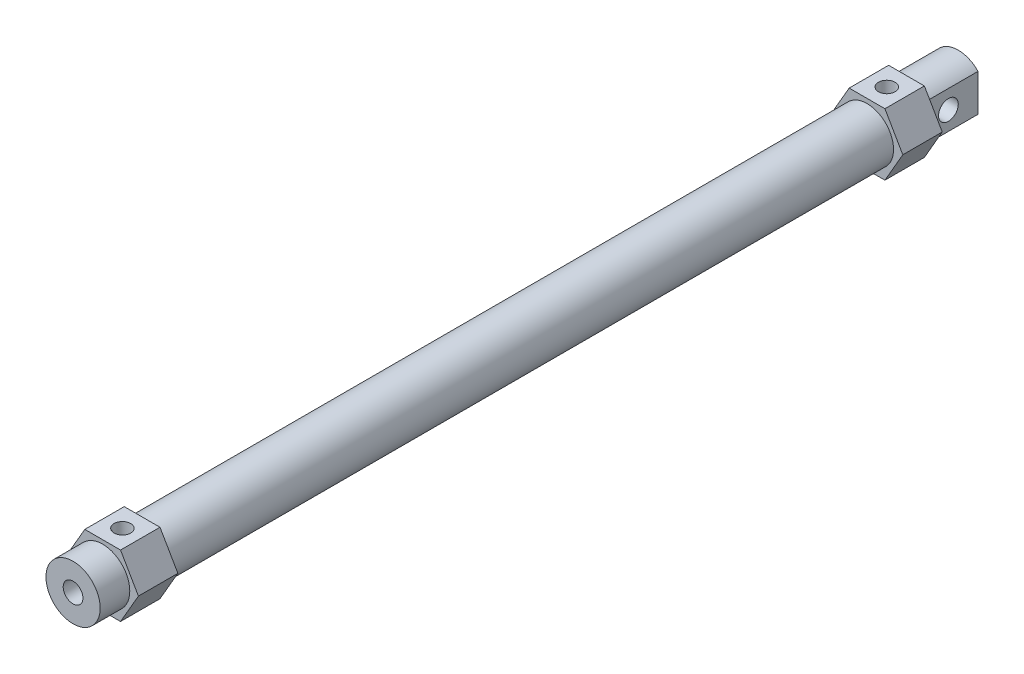
from build123d import *

# Parameters (mm, degrees)
EXTRUDE_1_DEPTH       = 16
SKETCH_3_R            = 10.75
SKETCH_3_R_2          = 10
EXTRUDE_3_DEPTH       = 294
EXTRUDE_4_DEPTH       = 16
F_1_8_RC_1_AT_2_COUNT = 2
F_1_8_RC_1_AT_2_PITCH = 310
SKETCH_8_R            = 11
EXTRUDE_5_DEPTH       = 12
SKETCH_9_R            = 4
CUT_EXTRUDE_1_DEPTH   = 50
EXTRUDE_START         = 21
SKETCH_10_R           = 11
EXTRUDE_6_DEPTH       = 21
SKETCH_11_R           = 22.5
SKETCH_11_W           = 16
SKETCH_11_H           = 30
CUT_EXTRUDE_2_DEPTH   = 21
SKETCH_12_R           = 4
CUT_EXTRUDE_3_DEPTH   = 339.980733332


with BuildPart() as part:
    # 草图1 → 凸台-拉伸1 (new body)
    with BuildSketch(Plane.XY):
        Polygon((14.5, 0), (7.25, 12.557368355), (-7.25, 12.557368355), (-14.5, 0), (-7.25, -12.557368355), (7.25, -12.557368355), align=None)
    extrude(amount=EXTRUDE_1_DEPTH)

    # 草图3 → 凸台-拉伸3 (add)
    with BuildSketch(Plane.XY.offset(16)):
        Circle(SKETCH_3_R)
        Circle(SKETCH_3_R_2, mode=Mode.SUBTRACT)
    extrude(amount=EXTRUDE_3_DEPTH)

    # 草图4 → 凸台-拉伸4 (add)
    with BuildSketch(Plane.XY.offset(310)):
        Polygon((14.5, 0), (7.25, 12.557368355), (-7.25, 12.557368355), (-14.5, 0), (-7.25, -12.557368355), (7.25, -12.557368355), align=None)
    extrude(amount=EXTRUDE_4_DEPTH)

    # 草图6 → 1/8 Rc 螺纹孔1 (revolve, cut)
    with BuildSketch(Plane(origin=(0, 12.557368355, 318), x_dir=(0, 0, 1), z_dir=(1, 0, 0))):
        Polygon((0, 0), (0, 17.849443543), (3.95, 14.535), (3.95, 10), (3.051996789, 10), (3.364163, 0), align=None)
    f_1_8_rc_1 = revolve(axis=Axis((0, 18.907368355, 318), (0, -1, 0)), mode=Mode.SUBTRACT)

    # 1/8 Rc 螺纹孔1 at 2: 1/8 Rc 螺纹孔1 ×2
    with Locations(*[(0, 0, -i * F_1_8_RC_1_AT_2_PITCH) for i in range(1, F_1_8_RC_1_AT_2_COUNT)]):
        add(f_1_8_rc_1, mode=Mode.SUBTRACT)

    # 草图8 → 凸台-拉伸5 (add)
    with BuildSketch(Plane.XY.offset(326)):
        Circle(SKETCH_8_R)
    extrude(amount=EXTRUDE_5_DEPTH)

    # 草图9 → 切除-拉伸1 (cut)
    with BuildSketch(Plane.XY.offset(338)):
        Circle(SKETCH_9_R)
    extrude(amount=-CUT_EXTRUDE_1_DEPTH, mode=Mode.SUBTRACT)

    # 草图10 → 凸台-拉伸6 (add)
    with BuildSketch(Plane(origin=(0, 0, 0), x_dir=(-1, 0, 0), z_dir=(0, 0, -1)).offset(EXTRUDE_START)):
        with Locations(Location((0, 0, 0), (0, 0, 180))):
            Circle(SKETCH_10_R)
    extrude(amount=-EXTRUDE_6_DEPTH)

    # 草图11 → 切除-拉伸2 (cut)
    with BuildSketch(Plane(origin=(0, 0, -21), x_dir=(-1, 0, 0), z_dir=(0, 0, -1))):
        Circle(SKETCH_11_R)
        Rectangle(SKETCH_11_W, SKETCH_11_H, mode=Mode.SUBTRACT)
    extrude(amount=-CUT_EXTRUDE_2_DEPTH, mode=Mode.SUBTRACT)

    # 草图12 → 切除-拉伸3 (cut, through all)
    with BuildSketch(Plane.ZY.offset(8)):
        with Locations(Location((-9, 0, 0), (0, 0, 270))):
            Circle(SKETCH_12_R)
    extrude(amount=-CUT_EXTRUDE_3_DEPTH, mode=Mode.SUBTRACT)


solid = part.part
